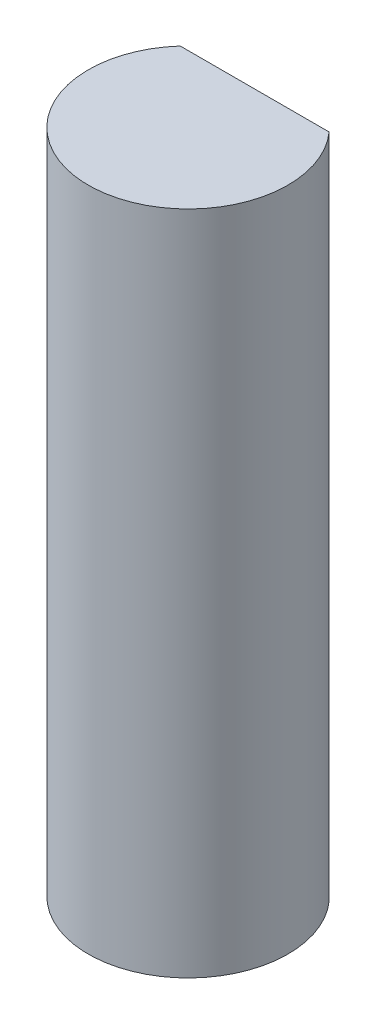
from build123d import *

# Parameters (mm, degrees)
BOSS_EXTRUDE1_DEPTH = 10


with BuildPart() as part:
    # Sketch1 → Boss-Extrude1 (new body)
    with BuildSketch(Plane(origin=(0, 0, 0), x_dir=(1, 0, 0), z_dir=(0, 1, 0))):
        with BuildLine():
            Line((1.118033989, 1), (-1.118033989, 1))
            ThreePointArc((-1.118033989, 1), (-0.535233135, -1.401258538), (1.5, 0))
            ThreePointArc((1.5, 0), (1.401258538, 0.535233135), (1.118033989, 1))
        make_face()
    extrude(amount=BOSS_EXTRUDE1_DEPTH)


solid = part.part
